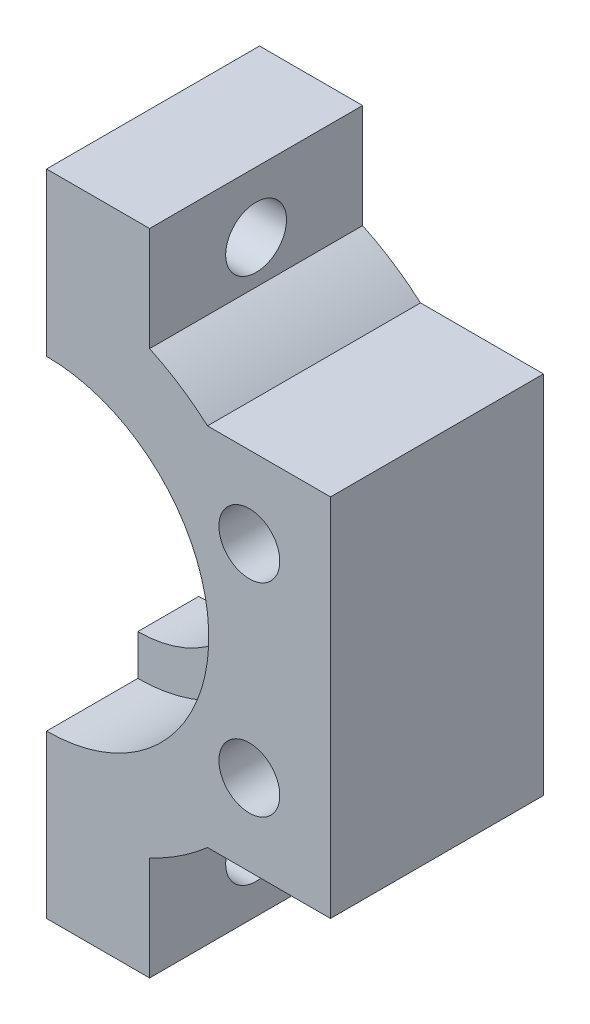
from build123d import *

# Parameters (mm, degrees)
SKETCH2_R           = 1.5
BOSS_EXTRUDE1_DEPTH = 10.5
SKETCH3_R           = 8
CUT_EXTRUDE1_DEPTH  = 4.5
SKETCH5_R           = 1.5
CUT_EXTRUDE3_DEPTH  = 22.113593143
CUT_EXTRUDE2_START  = -3
SKETCH4_R           = 8
CUT_EXTRUDE2_DEPTH  = 3


with BuildPart() as part:
    # Sketch2 → Boss-Extrude1 (new body)
    with BuildSketch(Plane.XY):
        with BuildLine():
            Line((7.937253933, 9), (14, 9))
            Line((14, 9), (14, -9))
            Line((14, -9), (7.937253933, -9))
            ThreePointArc((7.937253933, -9), (6.576406328, -10.037473776), (5.081826677, -10.870834265))
            Line((5.081826677, -10.870834265), (5.081826677, -16))
            Line((5.081826677, -16), (0, -16))
            Line((0, -16), (0, -9))
            Line((0, -9), (0, -6))
            ThreePointArc((0, -6), (6, 0), (0, 6))
            Line((0, 6), (0, 9))
            Line((0, 9), (0, 16))
            Line((0, 16), (5.081826677, 16))
            Line((5.081826677, 16), (5.081826677, 10.870834265))
            ThreePointArc((5.081826677, 10.870834265), (6.576406328, 10.037473776), (7.937253933, 9))
        make_face()
        with Locations((10, 5)):
            Circle(SKETCH2_R, mode=Mode.SUBTRACT)
        with Locations((10, -5)):
            Circle(SKETCH2_R, mode=Mode.SUBTRACT)
    extrude(amount=BOSS_EXTRUDE1_DEPTH)

    # Sketch3 → Cut-Extrude1 (cut)
    with BuildSketch(Plane.XY.offset(10.5)):
        Circle(SKETCH3_R)
    extrude(amount=-CUT_EXTRUDE1_DEPTH, mode=Mode.SUBTRACT)

    # Sketch5 → Cut-Extrude3 (cut, through all)
    with BuildSketch(Plane(origin=(5.081826677, 0, 0), x_dir=(0, 0, -1), z_dir=(1, 0, 0))):
        with Locations((-5.25, 13)):
            Circle(SKETCH5_R)
        with Locations((-5.25, -13)):
            Circle(SKETCH5_R)
    extrude(amount=-CUT_EXTRUDE3_DEPTH, mode=Mode.SUBTRACT)

    # Sketch4 → Cut-Extrude2 (cut)
    with BuildSketch(Plane(origin=(0, 0, 0), x_dir=(-1, 0, 0), z_dir=(0, 0, -1)).offset(CUT_EXTRUDE2_START)):
        Circle(SKETCH4_R)
    extrude(amount=CUT_EXTRUDE2_DEPTH, mode=Mode.SUBTRACT)


solid = part.part
